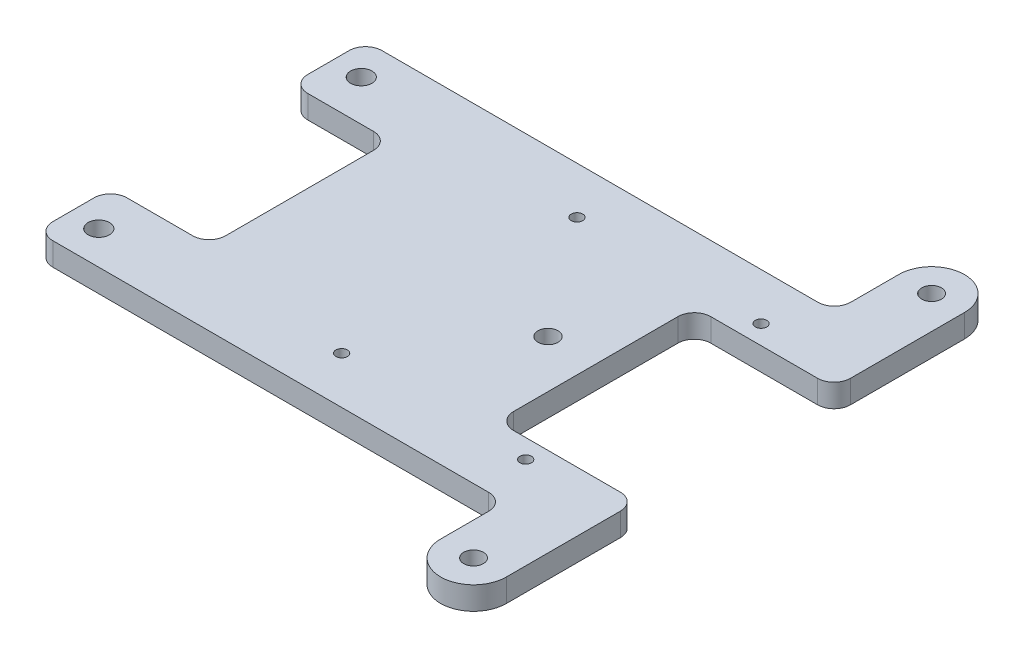
from build123d import *

# Parameters (mm, degrees)
CROQUIS2_R              = 3
CROQUIS2_R_2            = 3.25
SALIENTE_EXTRUIR1_DEPTH = 7
CORTAR_EXTRUIR3_DEPTH   = 7
CROQUIS4_W              = 60
CROQUIS4_H              = 55
CORTAR_EXTRUIR4_DEPTH   = 7
REDONDEO1_R             = 5
CORTAR_EXTRUIR5_DEPTH   = 10
REDONDEO2_R             = 5


with BuildPart() as part:
    # Croquis2 → Saliente-Extruir1 (new body)
    with BuildSketch(Plane(origin=(0, 8, 0), x_dir=(1, 0, 0), z_dir=(0, 1, 0))):
        with BuildLine():
            Line((162.6, -69.675), (162.6, 69.675))
            ThreePointArc((162.6, 69.675), (152.6, 79.675), (142.6, 69.675))
            Line((142.6, 69.675), (142.6, 50.075))
            Line((142.6, 50.075), (8.85, 50.075))
            Line((8.85, 50.075), (0, 50.075))
            Line((0, 50.075), (0, -50.075))
            Line((0, -50.075), (8.85, -50.075))
            Line((8.85, -50.075), (142.6, -50.075))
            Line((142.6, -50.075), (142.6, -69.675))
            ThreePointArc((142.6, -69.675), (152.6, -79.675), (162.6, -69.675))
        make_face()
        with Locations(Location((152.6, -69.675, 0), (0, 0, 90))):
            Circle(CROQUIS2_R, mode=Mode.SUBTRACT)
        with Locations(Location((8.85, -39.925, 0), (0, 0, 90))):
            Circle(CROQUIS2_R_2, mode=Mode.SUBTRACT)
        with Locations(Location((8.85, 39.925, 0), (0, 0, 90))):
            Circle(CROQUIS2_R_2, mode=Mode.SUBTRACT)
        with Locations(Location((152.6, 69.675, 0), (0, 0, 90))):
            Circle(CROQUIS2_R, mode=Mode.SUBTRACT)
    extrude(amount=SALIENTE_EXTRUIR1_DEPTH)

    # Croquis3 → Cortar-Extruir3 (cut)
    with BuildSketch(Plane(origin=(0, 15, 0), x_dir=(1, 0, 0), z_dir=(0, 1, 0))):
        with BuildLine():
            ThreePointArc((134.6, 34.049999999), (136.35, 35.799999999), (134.6, 37.549999999))
            ThreePointArc((134.6, 37.549999999), (132.85, 35.799999999), (134.6, 34.049999999))
        make_face()
        with BuildLine():
            ThreePointArc((78.6, 34.049999999), (80.35, 35.799999999), (78.6, 37.549999999))
            ThreePointArc((78.6, 37.549999999), (76.85, 35.799999999), (78.6, 34.049999999))
        make_face()
        with BuildLine():
            ThreePointArc((134.6, -34.050000001), (132.85, -35.800000001), (134.6, -37.550000001))
            ThreePointArc((134.6, -37.550000001), (136.35, -35.800000001), (134.6, -34.050000001))
        make_face()
        with BuildLine():
            ThreePointArc((78.6, -37.550000001), (80.35, -35.800000001), (78.6, -34.050000001))
            ThreePointArc((78.6, -34.050000001), (76.85, -35.800000001), (78.6, -37.550000001))
        make_face()
        with BuildLine():
            ThreePointArc((105.6, -3.052700001), (108.6527, -1e-09), (105.6, 3.052699999))
            ThreePointArc((105.6, 3.052699999), (102.5473, -1e-09), (105.6, -3.052700001))
        make_face()
    extrude(amount=-CORTAR_EXTRUIR3_DEPTH, mode=Mode.SUBTRACT)

    # Croquis4 → Cortar-Extruir4 (cut)
    with BuildSketch(Plane(origin=(0, 15, 0), x_dir=(1, 0, 0), z_dir=(0, 1, 0))):
        Rectangle(CROQUIS4_W, CROQUIS4_H)
    extrude(amount=-CORTAR_EXTRUIR4_DEPTH, mode=Mode.SUBTRACT)

    # Redondeo1
    redondeo1_edges = [part.edges().sort_by_distance(p)[0] for p in [
        (142.6, 11.5, 50.075),
        (0, 11.5, 50.075),
        (0, 11.5, -50.075),
        (142.6, 11.5, -50.075),
        (0, 11.5, -27.5),
        (0, 11.5, 27.5),
        (30, 11.5, 27.5),
        (30, 11.5, -27.5),
    ]]
    fillet(redondeo1_edges, radius=REDONDEO1_R)

    # Croquis5 → Cortar-Extruir5 (cut)
    with BuildSketch(Plane(origin=(0, 15, 0), x_dir=(1, 0, 0), z_dir=(0, 1, 0))):
        with BuildLine():
            Line((125.1, -30), (205.1, -30))
            Line((205.1, -30), (205.1, 30))
            Line((205.1, 30), (125.1, 30))
            ThreePointArc((125.1, 30), (121.564466094, 28.535533906), (120.1, 25))
            Line((120.1, 25), (120.1, -25))
            ThreePointArc((120.1, -25), (121.564466094, -28.535533906), (125.1, -30))
        make_face()
    extrude(amount=-CORTAR_EXTRUIR5_DEPTH, mode=Mode.SUBTRACT)

    # Redondeo2
    redondeo2_edges = [part.edges().sort_by_distance(p)[0] for p in [
        (162.6, 11.5, -30),
        (162.6, 11.5, 30),
    ]]
    fillet(redondeo2_edges, radius=REDONDEO2_R)


solid = part.part
